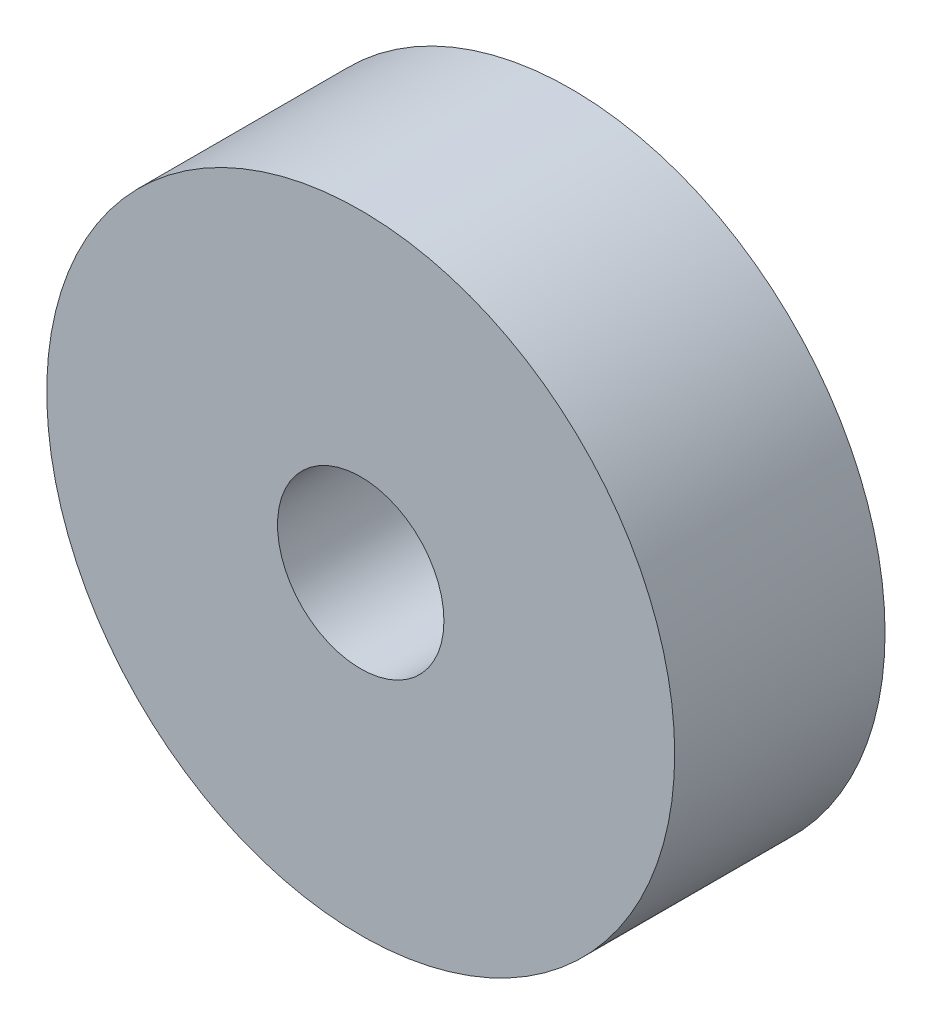
from build123d import *

# Parameters (mm, degrees)
SCHIZZO1_R                   = 100
SCHIZZO1_R_2                 = 26.5
ESTRUSIONE_ESTRUSIONE1_DEPTH = 67


with BuildPart() as part:
    # Schizzo1 → Estrusione-Estrusione1 (new body)
    with BuildSketch(Plane.XY):
        Circle(SCHIZZO1_R)
        Circle(SCHIZZO1_R_2, mode=Mode.SUBTRACT)
    extrude(amount=ESTRUSIONE_ESTRUSIONE1_DEPTH)


solid = part.part
